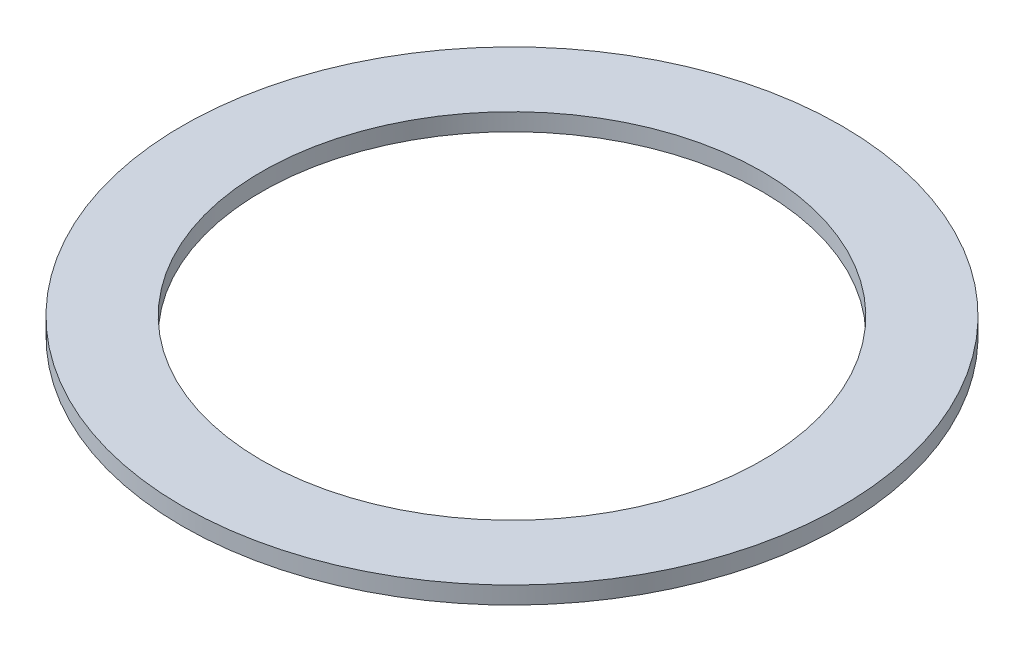
from build123d import *

# Parameters (mm, degrees)
SKETCH1_R           = 38.0746
SKETCH1_R_2         = 28.9052
BOSS_EXTRUDE1_DEPTH = 2.0066


with BuildPart() as part:
    # Sketch1 → Boss-Extrude1 (new body)
    with BuildSketch(Plane(origin=(0, 0, 0), x_dir=(1, 0, 0), z_dir=(0, 1, 0))):
        with Locations(Location((0, 0, 0), (0, 0, 270))):
            Circle(SKETCH1_R)
        with Locations(Location((0, 0, 0), (0, 0, 270))):
            Circle(SKETCH1_R_2, mode=Mode.SUBTRACT)
    extrude(amount=BOSS_EXTRUDE1_DEPTH)


solid = part.part
